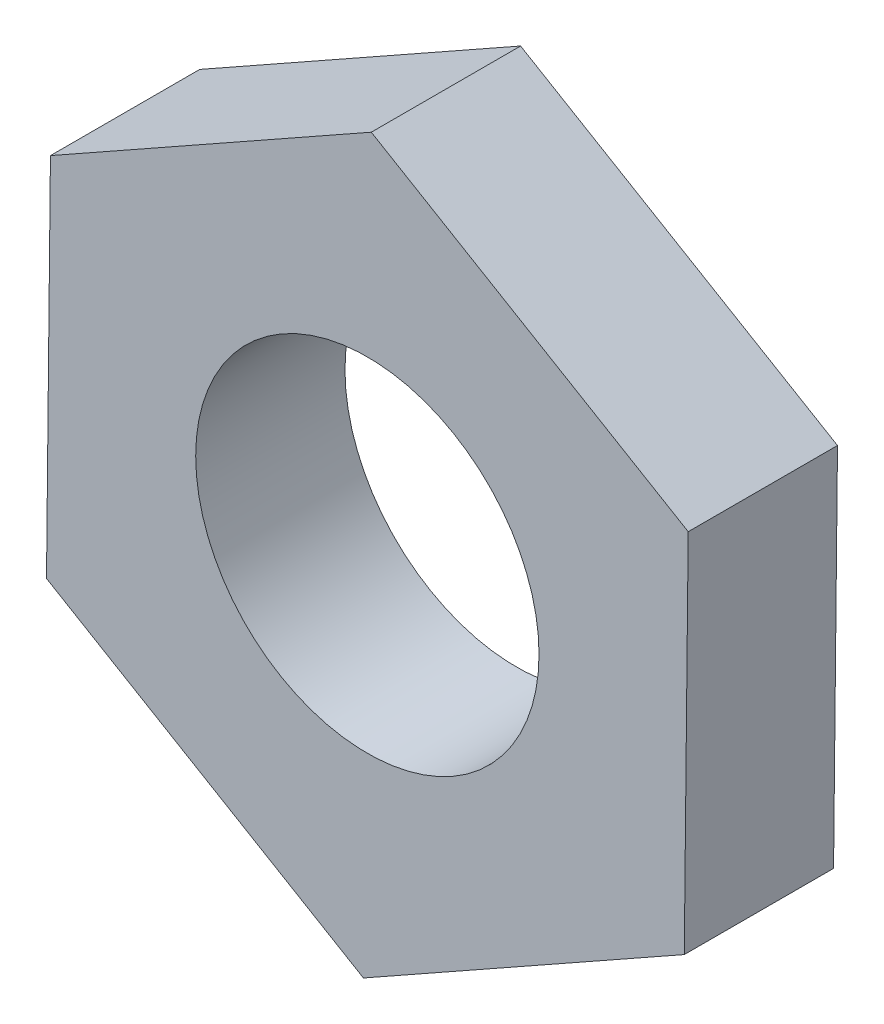
from build123d import *

# Parameters (mm, degrees)
SKETCH_1_R      = 3.45
EXTRUDE_1_DEPTH = 3


with BuildPart() as part:
    # 草图1 → 凸台-拉伸1 (new body)
    with BuildSketch(Plane.XY):
        Polygon((6.368625263, -3.768369974), (6.44781676, 3.631206278), (0.079191496, 7.399576252), (-6.368625263, 3.768369974), (-6.44781676, -3.631206278), (-0.079191496, -7.399576252), align=None)
        Circle(SKETCH_1_R, mode=Mode.SUBTRACT)
    extrude(amount=EXTRUDE_1_DEPTH)


solid = part.part
